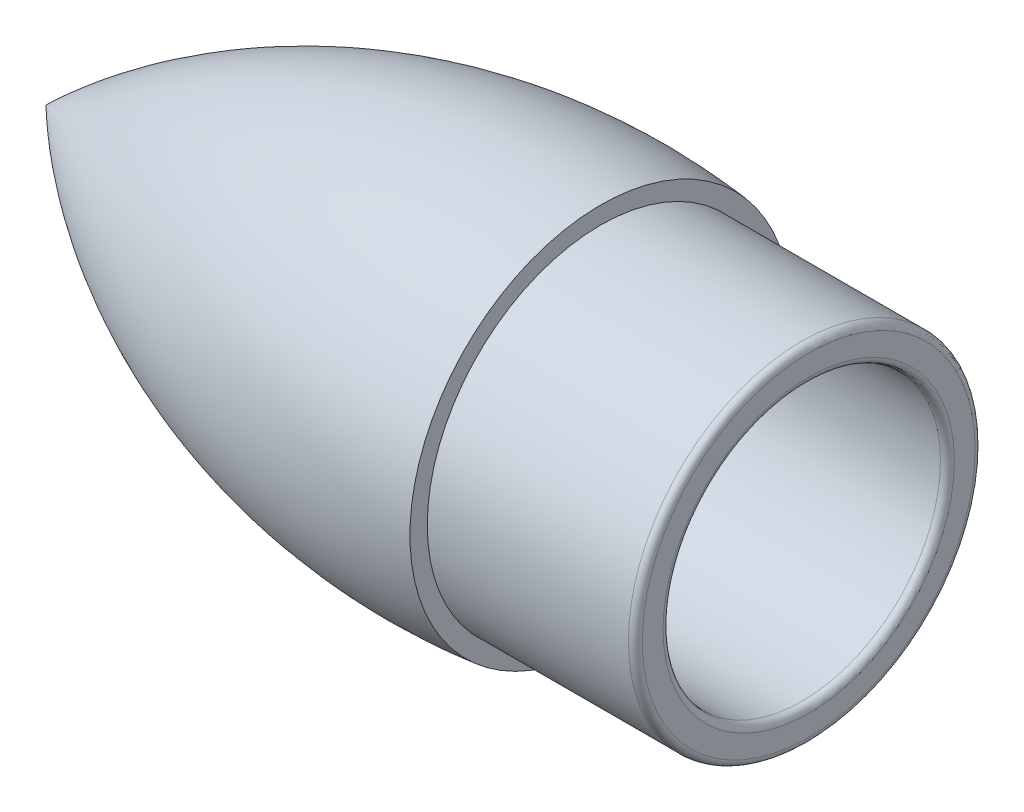
from build123d import *

# Parameters (mm, degrees)
SKETCH1_W = 5
SKETCH1_H = 2.5
FILLET1_R = 1


with BuildPart() as part:
    # Sketch1 → Revolve3 (revolve)
    with BuildSketch(Plane(origin=(0, 0, 0), x_dir=(1, 0, 0), z_dir=(0, 1, 0)), mode=Mode.PRIVATE) as revolve3_sk:
        with BuildLine():
            ThreePointArc((-49.928425666, 0), (-45.059304239, -3.56422662), (-40, -6.852918684))
            Line((-40, -6.852918684), (-40, 0))
            Line((-40, 0), (-49.928425666, 0))
        make_face()
        with BuildLine():
            ThreePointArc((-54.9783007, 0), (-47.77731302, -6.336592035), (-40, -11.950861744))
            Line((-40, -11.950861744), (-40, -6.852918684))
            ThreePointArc((-40, -6.852918684), (-45.059304239, -3.56422662), (-49.928425666, 0))
            Line((-49.928425666, 0), (-50, 0))
            Line((-50, 0), (-54.9783007, 0))
        make_face()
        with BuildLine():
            Line((-10.230105104, -25), (20, -25))
            Line((20, -25), (20, -22.766098724))
            ThreePointArc((20, -22.766098724), (-11.159419204, -19.181051795), (-40, -6.852918684))
            Line((-40, -6.852918684), (-40, -11.950861744))
            ThreePointArc((-40, -11.950861744), (-25.651143795, -19.698452627), (-10.230105104, -25))
        make_face()
        with BuildLine():
            Line((20, -27.5), (20, -25))
            Line((20, -25), (-10.230105104, -25))
            ThreePointArc((-10.230105104, -25), (-3.338382096, -26.495787967), (3.641932069, -27.5))
            Line((3.641932069, -27.5), (20, -27.5))
        make_face()
        with BuildLine():
            ThreePointArc((3.641932069, -27.5), (14.320966034, -28.074345047), (25, -27.5))
            Line((25, -27.5), (20, -27.5))
            Line((20, -27.5), (3.641932069, -27.5))
        make_face()
        with Locations((22.5, -21.25)):
            Rectangle(SKETCH1_W, SKETCH1_H)
        with BuildLine():
            Line((20, -25), (25, -25))
            Line((25, -25), (25, -22.5))
            ThreePointArc((25, -22.5), (22.501531547, -22.661827165), (20, -22.766098724))
            Line((20, -22.766098724), (20, -25))
        make_face()
        with Locations((22.5, -26.25)):
            Rectangle(SKETCH1_W, SKETCH1_H)
        Polygon((25, -22.5), (25, -25), (55, -25), (55, -20), (25, -20), align=None)
    revolve(revolve3_sk.sketch.rotate(Axis((55, 0, 0), (-1, 0, 0)), 180), axis=Axis((55, 0, 0), (-1, 0, 0)))

    # Fillet1
    fillet1_edges = [part.edges().sort_by_distance(p)[0] for p in [
        (55, 0, 20),
        (55, 0, 25),
    ]]
    fillet(fillet1_edges, radius=FILLET1_R)


solid = part.part
